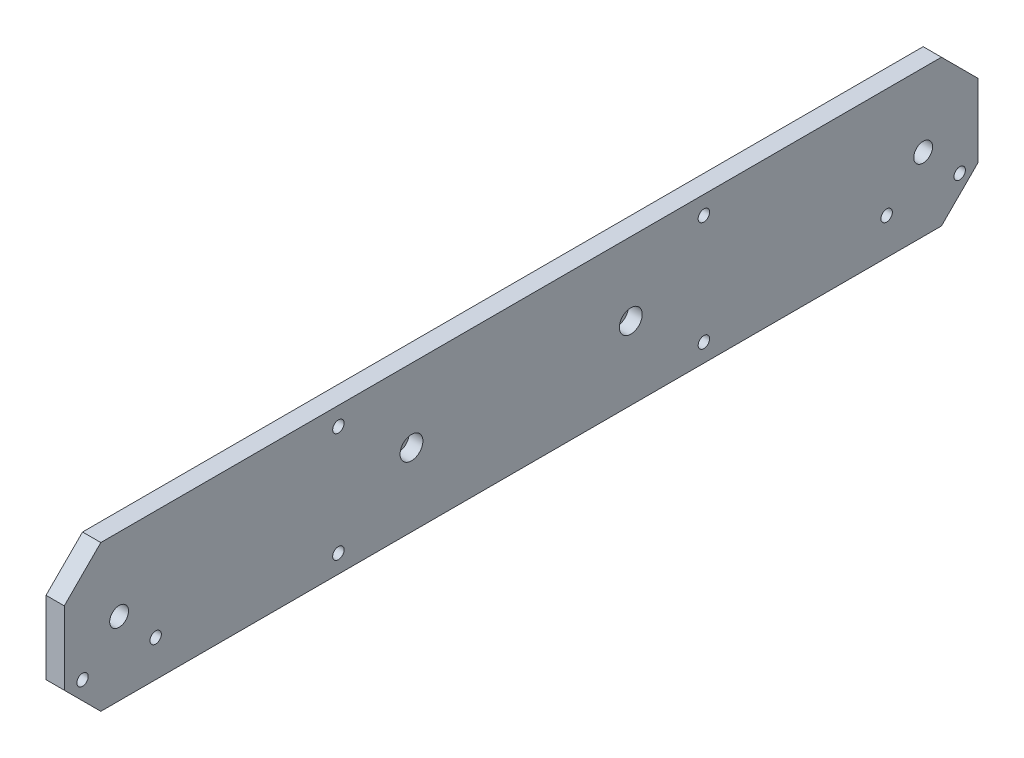
from build123d import *

# Parameters (mm, degrees)
SKETCH1_W                                        = 635
SKETCH1_H                                        = 101.6
BOSS_EXTRUDE1_DEPTH                              = 12.7
F_33_64_0_51563_DIAMETER_HOLE1_D                 = 13.097002
CHAMFER1_SIZE                                    = 25.4
F_3_8_16_TAPPED_HOLE1_D                          = 7.9375
F_3_8_16_TAPPED_HOLE2_D                          = 7.9375
LPATTERN1_COUNT                                  = 2
LPATTERN1_PITCH                                  = 254
LPATTERN1_COUNT_DIR2                             = 2
LPATTERN1_PITCH_DIR2                             = 76.2
CBORE_FOR_3_8_SOCKET_HEAD_CAP_SCREW2_D           = 9.8044
CBORE_FOR_3_8_SOCKET_HEAD_CAP_SCREW2_CBORE_D     = 15.875
CBORE_FOR_3_8_SOCKET_HEAD_CAP_SCREW2_CBORE_DEPTH = 9.525


with BuildPart() as part:
    # Sketch1 → Boss-Extrude1 (new body)
    with BuildSketch(Plane(origin=(0, 0, 0), x_dir=(0, 0, -1), z_dir=(1, 0, 0))):
        with Locations((317.5, 50.8)):
            Rectangle(SKETCH1_W, SKETCH1_H)
    extrude(amount=BOSS_EXTRUDE1_DEPTH)

    # 33/64 (0.51563) Diameter Hole1 (through all)
    with Locations(Plane(origin=(12.7, 0, 0), x_dir=(0, 0, -1), z_dir=(1, 0, 0))):
        with Locations((38.1, 50.8), (596.9, 50.8)):
            Hole(F_33_64_0_51563_DIAMETER_HOLE1_D / 2)

    # Chamfer1
    chamfer1_edges = [part.edges().sort_by_distance(p)[0] for p in [
        (6.35, 101.6, 0),
        (6.35, 101.6, -635),
        (6.35, 0, -635),
        (6.35, 0, 0),
    ]]
    chamfer(chamfer1_edges, length=CHAMFER1_SIZE)

    # 3/8-16 Tapped Hole1 (through all)
    with Locations(Plane.ZY):
        with Locations((-622.3, 25.4), (-571.5, 25.4), (-63.5, 25.4), (-12.7, 25.4)):
            Hole(F_3_8_16_TAPPED_HOLE1_D / 2)

    # 3/8-16 Tapped Hole2 (through all)
    with Locations(Plane(origin=(12.7, 0, 0), x_dir=(0, 0, -1), z_dir=(1, 0, 0))):
        with Locations((190.5, 12.7)):
            f_3_8_16_tapped_hole2 = Hole(F_3_8_16_TAPPED_HOLE2_D / 2)

    # LPattern1: 3_8-16 Tapped Hole2 2 × 2
    with Locations(*[(0, j * LPATTERN1_PITCH_DIR2, -i * LPATTERN1_PITCH) for i in range(LPATTERN1_COUNT) for j in range(LPATTERN1_COUNT_DIR2) if (i, j) != (0, 0)]):
        add(f_3_8_16_tapped_hole2, mode=Mode.SUBTRACT)

    # CBORE for 3/8 Socket Head Cap Screw2 (through all)
    with Locations(Plane(origin=(12.7, 0, 0), x_dir=(0, 0, -1), z_dir=(1, 0, 0))):
        with Locations((241.3, 50.8), (393.7, 50.8)):
            CounterBoreHole(CBORE_FOR_3_8_SOCKET_HEAD_CAP_SCREW2_D / 2, CBORE_FOR_3_8_SOCKET_HEAD_CAP_SCREW2_CBORE_D / 2, CBORE_FOR_3_8_SOCKET_HEAD_CAP_SCREW2_CBORE_DEPTH)


solid = part.part
